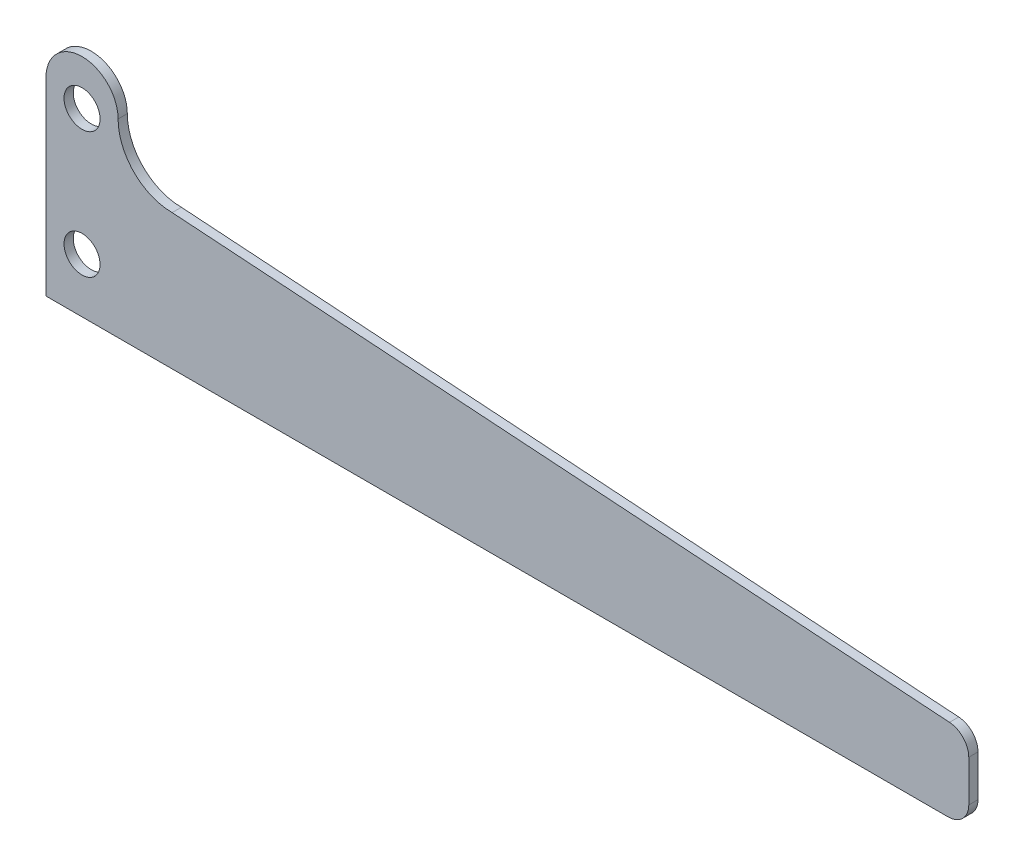
from build123d import *

# Parameters (mm, degrees)
SKETCH1_R           = 1.5875
BOSS_EXTRUDE1_DEPTH = 0.8128


with BuildPart() as part:
    # Sketch1 → Boss-Extrude1 (new body)
    with BuildSketch(Plane.XY):
        with BuildLine():
            Line((0, -0.8128), (79.461894979, -0.8128))
            ThreePointArc((79.461894979, -0.8128), (80.749213577, -0.279575177), (81.2824384, 1.007743421))
            Line((81.2824384, 1.007743421), (81.2824384, 4.648830263))
            ThreePointArc((81.2824384, 4.648830263), (80.792085251, 5.891799366), (79.585173538, 6.465194969))
            Line((79.585173538, 6.465194969), (11.1125, 11.1125))
            ThreePointArc((11.1125, 11.1125), (7.744903955, 12.507403955), (6.35, 15.875))
            ThreePointArc((6.35, 15.875), (3.175, 19.05), (0, 15.875))
            Line((0, 15.875), (0, -0.8128))
        make_face()
        with Locations((3.175, 3.96875)):
            Circle(SKETCH1_R, mode=Mode.SUBTRACT)
        with Locations((3.175, 15.08125)):
            Circle(SKETCH1_R, mode=Mode.SUBTRACT)
    extrude(amount=BOSS_EXTRUDE1_DEPTH)


solid = part.part
